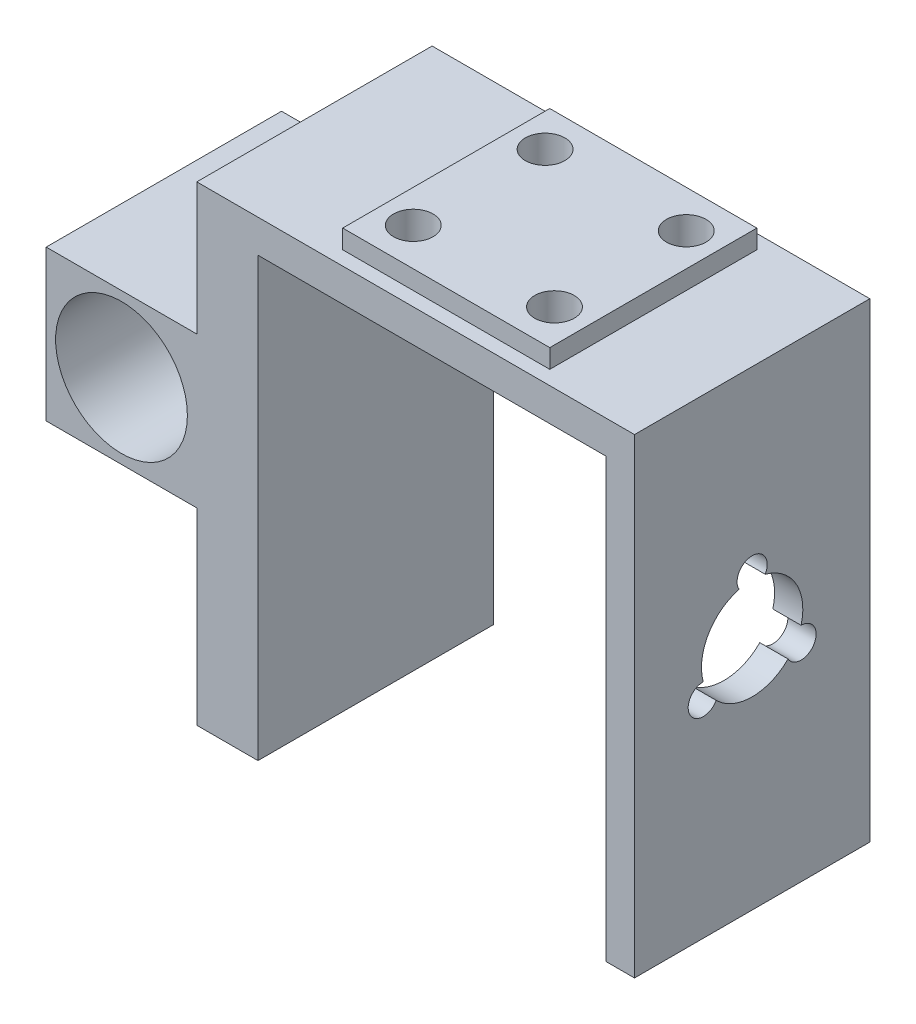
from build123d import *

# Parameters (mm, degrees)
SKETCH_1_W           = 50
SKETCH_1_H           = 50
EXTRUDE_1_DEPTH      = 25
CUT_EXTRUDE_1_DEPTH  = 12
SKETCH_5_W           = 16
SKETCH_5_H           = 16
EXTRUDE_2_DEPTH      = 25
SKETCH_6_R           = 7
CUT_EXTRUDE_3_DEPTH  = 25
SKETCH_7_R           = 2.1
CUT_EXTRUDE_4_DEPTH  = 7
SKETCH_10_R          = 2.1
CUT_EXTRUDE_5_DEPTH  = 26
SKETCH_15_W          = 22
SKETCH_15_H          = 22
EXTRUDE_3_DEPTH      = 2
SKETCH_16_R          = 2.1
CUT_EXTRUDE_6_DEPTH  = 4
SKETCH_24_W          = 37
SKETCH_24_H          = 37.580500644
CUT_EXTRUDE_7_DEPTH  = 25
SKETCH_23_R          = 1.6
CUT_EXTRUDE_8_DEPTH  = 11
SKETCH_25_R          = 5.384887306
CUT_EXTRUDE_9_DEPTH  = 9
SKETCH_27_W          = 3.5
SKETCH_27_H          = 50
CUT_EXTRUDE_10_DEPTH = 25


with BuildPart() as part:
    # 草图1 → 凸台-拉伸1 (new body)
    with BuildSketch(Plane.XY):
        Rectangle(SKETCH_1_W, SKETCH_1_H)
    extrude(amount=EXTRUDE_1_DEPTH)

    # 草图3 → 切除-拉伸1 (cut)
    with BuildSketch(Plane.XY.offset(25)):
        Polygon((-18.5, -15.5), (-18.5, -25), (18.5, -25), (18.5, -15.5), (18.5, 21.5), (-18.5, 21.5), align=None)
    extrude(amount=-CUT_EXTRUDE_1_DEPTH, mode=Mode.SUBTRACT)

    # 草图5 → 凸台-拉伸2 (add)
    with BuildSketch(Plane.XY.offset(25)):
        with Locations((-33, 3)):
            Rectangle(SKETCH_5_W, SKETCH_5_H)
    extrude(amount=-EXTRUDE_2_DEPTH)

    # 草图6 → 切除-拉伸3 (cut)
    with BuildSketch(Plane.XY.offset(25)):
        with Locations((-33, 3)):
            Circle(SKETCH_6_R)
    extrude(amount=-CUT_EXTRUDE_3_DEPTH, mode=Mode.SUBTRACT)

    # 草图7 → 切除-拉伸4 (cut)
    with BuildSketch(Plane.ZY.offset(41)):
        with Locations(Location((12.5, 3, 0), (0, 0, 270))):
            Circle(SKETCH_7_R)
    extrude(amount=-CUT_EXTRUDE_4_DEPTH, mode=Mode.SUBTRACT)

    # 草图10 → 切除-拉伸5 (cut)
    with BuildSketch(Plane(origin=(0, 11, 0), x_dir=(1, 0, 0), z_dir=(0, 1, 0))):
        with Locations(Location((-33, -12.5, 0), (0, 0, 270))):
            Circle(SKETCH_10_R)
    extrude(amount=-CUT_EXTRUDE_5_DEPTH, mode=Mode.SUBTRACT)

    # 草图15 → 凸台-拉伸3 (add)
    with BuildSketch(Plane(origin=(0, 25, 0), x_dir=(1, 0, 0), z_dir=(0, 1, 0))):
        with Locations((0, -12.5)):
            Rectangle(SKETCH_15_W, SKETCH_15_H)
    extrude(amount=EXTRUDE_3_DEPTH)

    # 草图16 → 切除-拉伸6 (cut)
    with BuildSketch(Plane(origin=(0, 27, 0), x_dir=(1, 0, 0), z_dir=(0, 1, 0))):
        with Locations(Location((-7.5, -5.5, 0), (0, 0, 270))):
            Circle(SKETCH_16_R)
        with Locations(Location((7.5, -5.5, 0), (0, 0, 270))):
            Circle(SKETCH_16_R)
        with Locations(Location((-7.5, -19.5, 0), (0, 0, 270))):
            Circle(SKETCH_16_R)
        with Locations(Location((7.5, -19.5, 0), (0, 0, 270))):
            Circle(SKETCH_16_R)
    extrude(amount=-CUT_EXTRUDE_6_DEPTH, mode=Mode.SUBTRACT)

    # 草图24 → 切除-拉伸7 (cut)
    with BuildSketch(Plane.XY.offset(13)):
        with Locations((0, -7.067744148)):
            Rectangle(SKETCH_24_W, SKETCH_24_H)
    extrude(amount=-CUT_EXTRUDE_7_DEPTH, mode=Mode.SUBTRACT)

    # 草图23 → 切除-拉伸8 (cut)
    with BuildSketch(Plane(origin=(25, 0, 0), x_dir=(0, 0, -1), z_dir=(1, 0, 0))):
        with Locations(Location((-12.5, 6, 0), (0, 0, 90))):
            Circle(SKETCH_23_R)
        with Locations(Location((-7.303847577, -3, 0), (0, 0, 90))):
            Circle(SKETCH_23_R)
        with Locations(Location((-17.696152423, -3, 0), (0, 0, 90))):
            Circle(SKETCH_23_R)
    extrude(amount=-CUT_EXTRUDE_8_DEPTH, mode=Mode.SUBTRACT)

    # 草图25 → 切除-拉伸9 (cut)
    with BuildSketch(Plane(origin=(25, 0, 0), x_dir=(0, 0, -1), z_dir=(1, 0, 0))):
        with Locations((-12.5, 0)):
            Circle(SKETCH_25_R)
    extrude(amount=-CUT_EXTRUDE_9_DEPTH, mode=Mode.SUBTRACT)

    # 草图27 → 切除-拉伸10 (cut)
    with BuildSketch(Plane.XY.offset(25)):
        with Locations((23.25, 0)):
            Rectangle(SKETCH_27_W, SKETCH_27_H)
    extrude(amount=-CUT_EXTRUDE_10_DEPTH, mode=Mode.SUBTRACT)


solid = part.part
